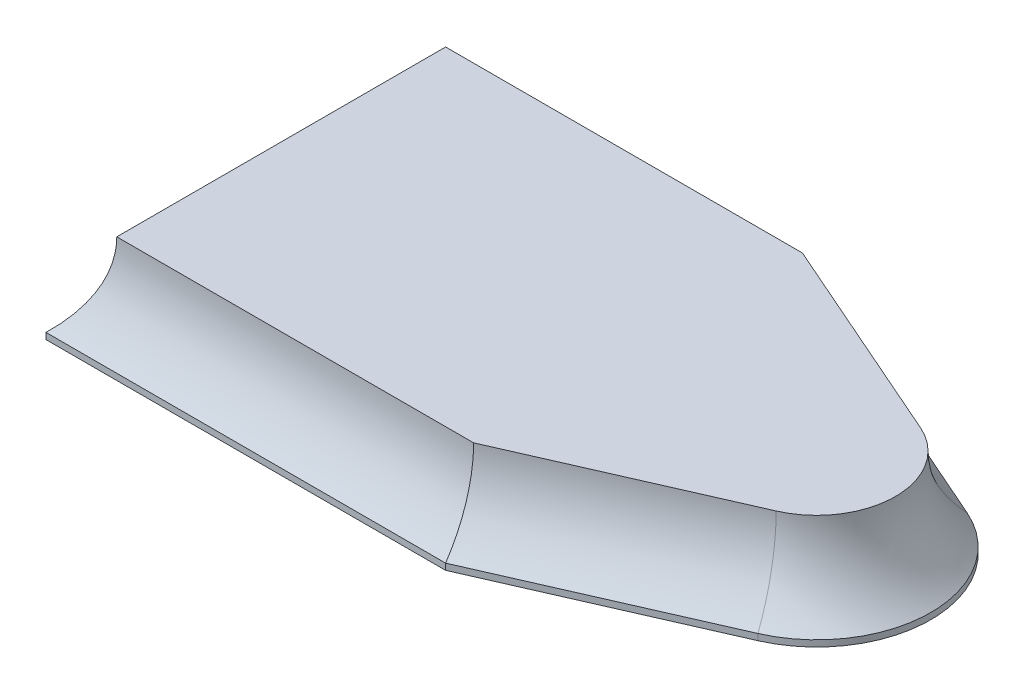
from build123d import *

# Parameters (mm, degrees)
BOSS_EXTRUDE1_DEPTH = 0.44


with BuildPart() as part:
    # Sweep2: sweep along a path in Sketch1
    with BuildLine(Plane(origin=(0, 0, 0), x_dir=(1, 0, 0), z_dir=(0, 1, 0))) as sweep2_path:
        Line((7, 7), (10.80344393, 5.331523369))
        ThreePointArc((10.80344393, 5.331523369), (12, 3.5), (10.80344393, 1.668476631))
        Line((10.80344393, 1.668476631), (7, 0))
        Line((7, 0), (0, 0))
        Line((0, 0), (0, 7))
        Line((0, 7), (7, 7))
    # Sketch2 → Sweep2 (sweep)
    with BuildSketch(Plane(origin=(0, 0, 0), x_dir=(0, 0, -1), z_dir=(1, 0, 0))):
        with BuildLine():
            Line((0, 0), (0, 0.11))
            ThreePointArc((0, 0.11), (0.458946824, 0.771312392), (0.62, 1.56))
            Line((0.62, 1.56), (1.88, 1.56))
            Line((1.88, 1.56), (1.88, 1.12))
            Line((1.88, 1.12), (0.88, 1.12))
            Line((0.88, 1.12), (0.44, 0))
            Line((0.44, 0), (0, 0))
        make_face()
    sweep(path=sweep2_path.line, transition=Transition.RIGHT)

    # Sketch9 → Boss-Extrude1 (add)
    with BuildSketch(Plane(origin=(0, 1.56, 0), x_dir=(1, 0, 0), z_dir=(0, 1, 0))):
        with BuildLine():
            Line((6.605777013, 1.88), (10.048206636, 3.390108598))
            ThreePointArc((10.048206636, 3.390108598), (10.12, 3.5), (10.048206636, 3.609891402))
            Line((10.048206636, 3.609891402), (6.605777013, 5.12))
            Line((6.605777013, 5.12), (1.88, 5.12))
            Line((1.88, 5.12), (1.88, 1.88))
            Line((1.88, 1.88), (6.605777013, 1.88))
        make_face()
    extrude(amount=-BOSS_EXTRUDE1_DEPTH)


solid = part.part
